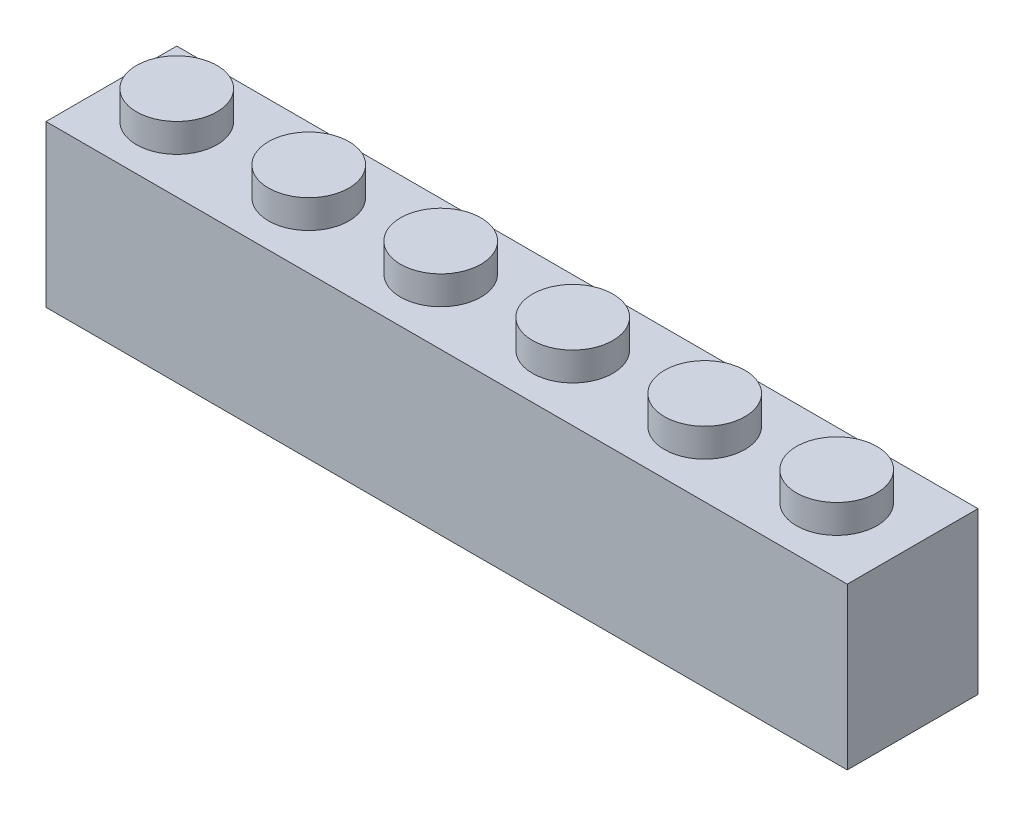
from build123d import *

# Parameters (mm, degrees)
SKETCH_1_W          = 47.8
SKETCH_1_H          = 7.8
EXTRUDE_1_DEPTH     = 9.6
SKETCH_2_R          = 2.4
EXTRUDE_2_DEPTH     = 1.7
SKETCH_3_R          = 2.5
CUT_EXTRUDE_1_DEPTH = 1.8


with BuildPart() as part:
    # Эскиз1 → Бобышка-Вытянуть1 (new body)
    with BuildSketch(Plane(origin=(0, 0, 0), x_dir=(1, 0, 0), z_dir=(0, 1, 0))):
        Rectangle(SKETCH_1_W, SKETCH_1_H)
    extrude(amount=EXTRUDE_1_DEPTH)

    # Эскиз2 → Бобышка-Вытянуть2 (add)
    with BuildSketch(Plane(origin=(0, 9.6, 0), x_dir=(1, 0, 0), z_dir=(0, 1, 0))):
        with Locations(Location((-20, 0, 0), (0, 0, 270))):
            Circle(SKETCH_2_R)
        with Locations(Location((-12.126, 0, 0), (0, 0, 270))):
            Circle(SKETCH_2_R)
        with Locations(Location((-4.252, 0, 0), (0, 0, 270))):
            Circle(SKETCH_2_R)
        with Locations(Location((3.622, 0, 0), (0, 0, 270))):
            Circle(SKETCH_2_R)
        with Locations(Location((11.496, 0, 0), (0, 0, 270))):
            Circle(SKETCH_2_R)
        with Locations(Location((19.37, 0, 0), (0, 0, 270))):
            Circle(SKETCH_2_R)
    extrude(amount=EXTRUDE_2_DEPTH)

    # Эскиз3 → Вырез-Вытянуть1 (cut)
    with BuildSketch(Plane.XZ):
        with Locations(Location((-20, 0, 0), (0, 0, 270))):
            Circle(SKETCH_3_R)
        with Locations(Location((-12.126, 0, 0), (0, 0, 270))):
            Circle(SKETCH_3_R)
        with Locations(Location((-4.252, 0, 0), (0, 0, 270))):
            Circle(SKETCH_3_R)
        with Locations(Location((3.622, 0, 0), (0, 0, 270))):
            Circle(SKETCH_3_R)
        with Locations(Location((11.496, 0, 0), (0, 0, 270))):
            Circle(SKETCH_3_R)
        with Locations(Location((19.37, 0, 0), (0, 0, 270))):
            Circle(SKETCH_3_R)
    extrude(amount=-CUT_EXTRUDE_1_DEPTH, mode=Mode.SUBTRACT)


solid = part.part
